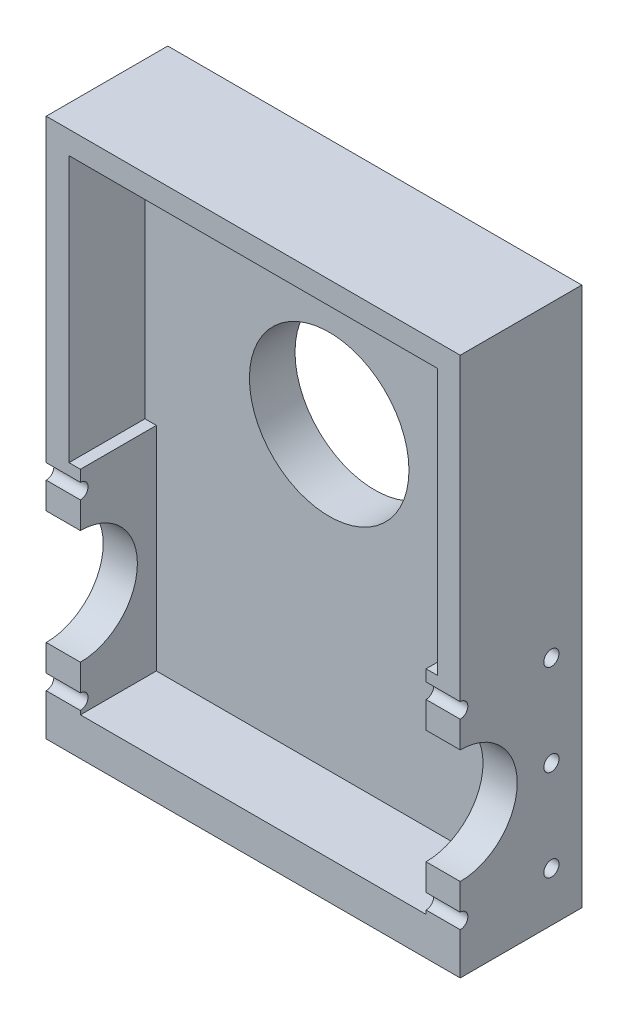
from build123d import *

# Parameters (mm, degrees)
SKETCH1_W           = 97
SKETCH1_H           = 130
BOSS_EXTRUDE1_DEPTH = 12
SKETCH9_R           = 32
CUT_EXTRUDE2_DEPTH  = 12
SKETCH11_W          = 109
SKETCH11_H          = 142
SKETCH11_W_2        = 97
SKETCH11_H_2        = 130
BOSS_EXTRUDE4_DEPTH = 32
SKETCH18_W          = 20
SKETCH18_H          = 60
BOSS_EXTRUDE5_DEPTH = 3
SKETCH14_R          = 15
CUT_EXTRUDE5_DEPTH  = 134.962681371
SKETCH20_W          = 91
SKETCH20_H          = 20
BOSS_EXTRUDE6_DEPTH = 4
SKETCH21_R          = 2
CUT_EXTRUDE6_DEPTH  = 9
SKETCH23_R          = 2
CUT_EXTRUDE7_DEPTH  = 6
BOSS_EXTRUDE7_START = -12
SKETCH26_R          = 32
SKETCH26_R_2        = 21
BOSS_EXTRUDE7_DEPTH = 12


with BuildPart() as part:
    # Sketch1 → Boss-Extrude1 (new body)
    with BuildSketch(Plane.XY):
        Rectangle(SKETCH1_W, SKETCH1_H)
    extrude(amount=BOSS_EXTRUDE1_DEPTH)

    # Sketch9 → Cut-Extrude2 (cut)
    with BuildSketch(Plane.XY.offset(12)):
        with Locations((0, 18)):
            Circle(SKETCH9_R)
    extrude(amount=-CUT_EXTRUDE2_DEPTH, mode=Mode.SUBTRACT)

    # Sketch11 → Boss-Extrude4 (add)
    with BuildSketch(Plane.XY):
        Rectangle(SKETCH11_W, SKETCH11_H)
        Rectangle(SKETCH11_W_2, SKETCH11_H_2, mode=Mode.SUBTRACT)
    extrude(amount=BOSS_EXTRUDE4_DEPTH)

    # Sketch18 → Boss-Extrude5 (add)
    with BuildSketch(Plane(origin=(-48.5, 0, 0), x_dir=(0, 0, -1), z_dir=(1, 0, 0))):
        with Locations((-22, -35)):
            Rectangle(SKETCH18_W, SKETCH18_H)
    boss_extrude5 = extrude(amount=BOSS_EXTRUDE5_DEPTH)

    # Mirror1: Boss-Extrude5 across plane
    add(boss_extrude5.mirror(Plane(origin=(0, 0, 0), x_dir=(0, 0, 1), z_dir=(1, 0, 0))))

    # Sketch14 → Cut-Extrude5 (cut, through all)
    with BuildSketch(Plane.ZY.offset(54.5)):
        with Locations((32, -34)):
            Circle(SKETCH14_R)
    extrude(amount=-CUT_EXTRUDE5_DEPTH, mode=Mode.SUBTRACT)

    # Sketch20 → Boss-Extrude6 (add)
    with BuildSketch(Plane(origin=(0, -65, 0), x_dir=(1, 0, 0), z_dir=(0, 1, 0))):
        with Locations((0, -22)):
            Rectangle(SKETCH20_W, SKETCH20_H)
    extrude(amount=BOSS_EXTRUDE6_DEPTH)

    # Sketch21 → Cut-Extrude6 (cut)
    with BuildSketch(Plane.ZY.offset(54.5)):
        with Locations((32, -10)):
            Circle(SKETCH21_R)
        with Locations((8, -10)):
            Circle(SKETCH21_R)
        with Locations((56, -10)):
            Circle(SKETCH21_R)
        with Locations((56, -58)):
            Circle(SKETCH21_R)
        with Locations((32, -58)):
            Circle(SKETCH21_R)
        with Locations(Location((8, -58, 0), (0, 0, 180))):
            Circle(SKETCH21_R)
        with Locations((8, -34)):
            Circle(SKETCH21_R)
    cut_extrude6 = extrude(amount=-CUT_EXTRUDE6_DEPTH, mode=Mode.SUBTRACT)

    # Mirror2: Cut-Extrude6 across plane
    add(cut_extrude6.mirror(Plane(origin=(0, 0, 0), x_dir=(0, 0, 1), z_dir=(1, 0, 0))), mode=Mode.SUBTRACT)

    # Sketch23 → Cut-Extrude7 (cut)
    with BuildSketch(Plane(origin=(0, 0, 0), x_dir=(-1, 0, 0), z_dir=(0, 0, -1))):
        with Locations((0, 56)):
            Circle(SKETCH23_R)
        with Locations((32.908965344, 37)):
            Circle(SKETCH23_R)
        with Locations((32.908965344, -1)):
            Circle(SKETCH23_R)
        with Locations((0, -20)):
            Circle(SKETCH23_R)
        with Locations((-32.908965344, -1)):
            Circle(SKETCH23_R)
        with Locations((-32.908965344, 37)):
            Circle(SKETCH23_R)
    extrude(amount=-CUT_EXTRUDE7_DEPTH, mode=Mode.SUBTRACT)

    # Sketch26 → Boss-Extrude7 (add)
    with BuildSketch(Plane(origin=(0, 0, 0), x_dir=(-1, 0, 0), z_dir=(0, 0, -1)).offset(BOSS_EXTRUDE7_START)):
        with Locations((0, 18)):
            Circle(SKETCH26_R)
        with Locations((0, 18)):
            Circle(SKETCH26_R_2, mode=Mode.SUBTRACT)
    extrude(amount=BOSS_EXTRUDE7_DEPTH)


solid = part.part
